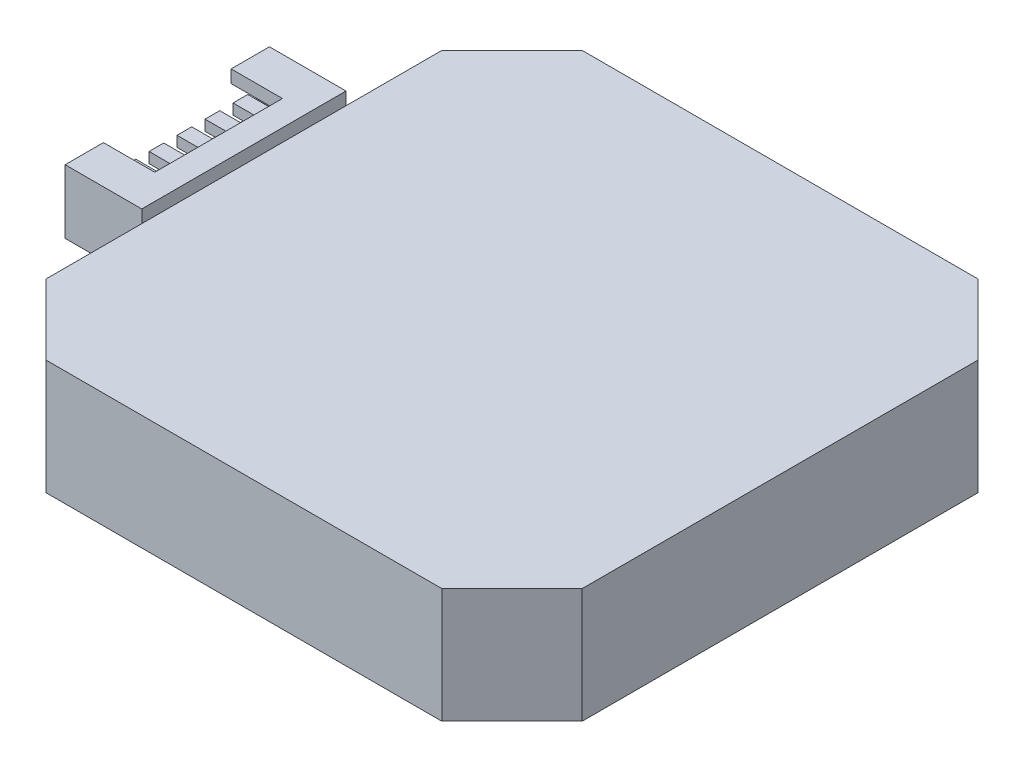
from build123d import *

# Parameters (mm, degrees)
SKETCH1_W           = 42
SKETCH1_H           = 42
NEMA_17_DEPTH       = 9
CHAMFER1_SIZE       = 5.5
SKETCH2_R           = 3
M6_BOLT_HOLES_DEPTH = 8
SKETCH3_W           = 16
SKETCH3_H           = 3
BOSS_EXTRUDE1_DEPTH = 4
SKETCH5_W           = 16
SKETCH5_H           = 5
BOSS_EXTRUDE2_DEPTH = 6
SKETCH6_W           = 14
SKETCH6_H           = 3
CUT_EXTRUDE1_DEPTH  = 5
SKETCH7_W           = 4.019368502
SKETCH7_H           = 10
CUT_EXTRUDE2_DEPTH  = 1
SKETCH8_W           = 1.150216319
SKETCH8_H           = 0.828591851
SKETCH8_W_2         = 1.150216318
BOSS_EXTRUDE3_DEPTH = 5
CHAMFER2_SIZE       = 0.3


with BuildPart() as part:
    # Sketch1 → Nema 17 (new body)
    with BuildSketch(Plane(origin=(0, 0, 0), x_dir=(1, 0, 0), z_dir=(0, 1, 0))):
        Rectangle(SKETCH1_W, SKETCH1_H)
    extrude(amount=NEMA_17_DEPTH)

    # Chamfer1
    chamfer1_edges = [part.edges().sort_by_distance(p)[0] for p in [
        (21, 4.5, 21),
        (-21, 4.5, 21),
        (-21, 4.5, -21),
        (21, 4.5, -21),
    ]]
    chamfer(chamfer1_edges, length=CHAMFER1_SIZE)

    # Sketch2 → M6 Bolt Holes (cut)
    with BuildSketch(Plane.XZ):
        with Locations(Location((-15.5, -15.5, 0), (0, 0, 270))):
            Circle(SKETCH2_R)
        with Locations(Location((15.5, -15.5, 0), (0, 0, 90))):
            Circle(SKETCH2_R)
        with Locations(Location((-15.5, 15.5, 0), (0, 0, 90))):
            Circle(SKETCH2_R)
        with Locations(Location((15.5, 15.5, 0), (0, 0, 270))):
            Circle(SKETCH2_R)
    extrude(amount=-M6_BOLT_HOLES_DEPTH, mode=Mode.SUBTRACT)

    # Sketch3 → Boss-Extrude1 (add)
    with BuildSketch(Plane.ZY.offset(21)):
        with Locations((0, 1.5)):
            Rectangle(SKETCH3_W, SKETCH3_H)
    extrude(amount=BOSS_EXTRUDE1_DEPTH)

    # Sketch5 → Boss-Extrude2 (add)
    with BuildSketch(Plane.ZY.offset(21)):
        with Locations((0, 7.5)):
            Rectangle(SKETCH5_W, SKETCH5_H)
    extrude(amount=BOSS_EXTRUDE2_DEPTH)

    # Sketch6 → Cut-Extrude1 (cut)
    with BuildSketch(Plane.ZY.offset(27)):
        with Locations((0, 7.5)):
            Rectangle(SKETCH6_W, SKETCH6_H)
    extrude(amount=-CUT_EXTRUDE1_DEPTH, mode=Mode.SUBTRACT)

    # Sketch7 → Cut-Extrude2 (cut)
    with BuildSketch(Plane(origin=(0, 10, 0), x_dir=(1, 0, 0), z_dir=(0, 1, 0))):
        with Locations((-24.990315749, 0)):
            Rectangle(SKETCH7_W, SKETCH7_H)
    extrude(amount=-CUT_EXTRUDE2_DEPTH, mode=Mode.SUBTRACT)

    # Sketch8 → Boss-Extrude3 (add)
    with BuildSketch(Plane.ZY.offset(22)):
        with Locations((5.539336093, 7.499295926)):
            Rectangle(SKETCH8_W, SKETCH8_H)
        with Locations((3.346490506, 7.499295926)):
            Rectangle(SKETCH8_W_2, SKETCH8_H)
        with Locations((1.15364492, 7.499295926)):
            Rectangle(SKETCH8_W, SKETCH8_H)
        with Locations((-1.039200668, 7.499295926)):
            Rectangle(SKETCH8_W, SKETCH8_H)
        with Locations((-3.232046254, 7.499295926)):
            Rectangle(SKETCH8_W_2, SKETCH8_H)
        with Locations((-5.42489184, 7.499295926)):
            Rectangle(SKETCH8_W, SKETCH8_H)
    extrude(amount=BOSS_EXTRUDE3_DEPTH)

    # Chamfer2
    chamfer2_edges = [part.edges().sort_by_distance(p)[0] for p in [
        (-27, 7.499295925, 4.964227933),
        (-27, 7.085, 5.539336093),
        (-27, 7.499295925, 6.114444252),
        (-27, 7.913591851, 5.539336093),
        (-27, 7.913591851, 3.346490506),
        (-27, 7.499295925, 2.771382347),
        (-27, 7.085, 3.346490506),
        (-27, 7.499295925, 3.921598665),
        (-27, 7.913591851, 1.153644919),
        (-27, 7.499295925, 0.57853676),
        (-27, 7.085, 1.153644919),
        (-27, 7.499295925, 1.728753079),
        (-27, 7.913591851, -1.039200667),
        (-27, 7.499295925, -1.614308827),
        (-27, 7.085, -1.039200667),
        (-27, 7.499295925, -0.464092508),
        (-27, 7.913591851, -3.232046254),
        (-27, 7.499295925, -3.807154413),
        (-27, 7.085, -3.232046254),
        (-27, 7.499295925, -2.656938095),
        (-27, 7.913591851, -5.424891841),
        (-27, 7.499295925, -6),
        (-27, 7.085, -5.424891841),
        (-27, 7.499295925, -4.849783681),
    ]]
    chamfer(chamfer2_edges, length=CHAMFER2_SIZE)


solid = part.part
